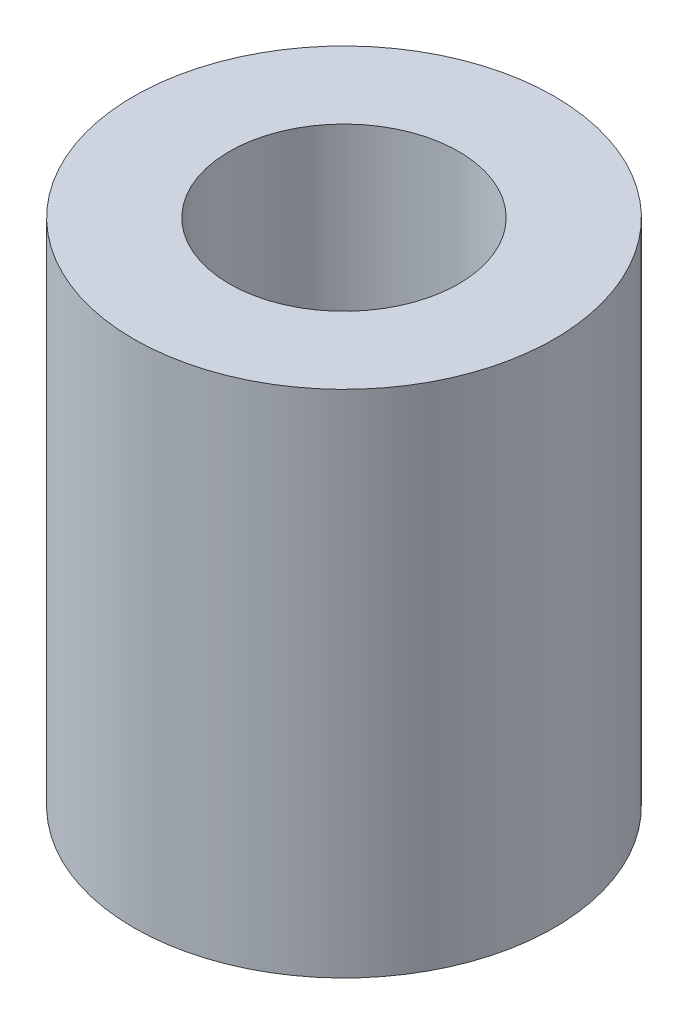
from build123d import *

# Parameters (mm, degrees)
SKETCH1_R           = 3.3
SKETCH1_R_2         = 1.8
BOSS_EXTRUDE1_DEPTH = 8


with BuildPart() as part:
    # Sketch1 → Boss-Extrude1 (new body)
    with BuildSketch(Plane(origin=(0, 0, 0), x_dir=(1, 0, 0), z_dir=(0, 1, 0))):
        with Locations(Location((0, 0, 0), (0, 0, 270))):
            Circle(SKETCH1_R)
        with Locations(Location((0, 0, 0), (0, 0, 270))):
            Circle(SKETCH1_R_2, mode=Mode.SUBTRACT)
    extrude(amount=BOSS_EXTRUDE1_DEPTH)


solid = part.part
